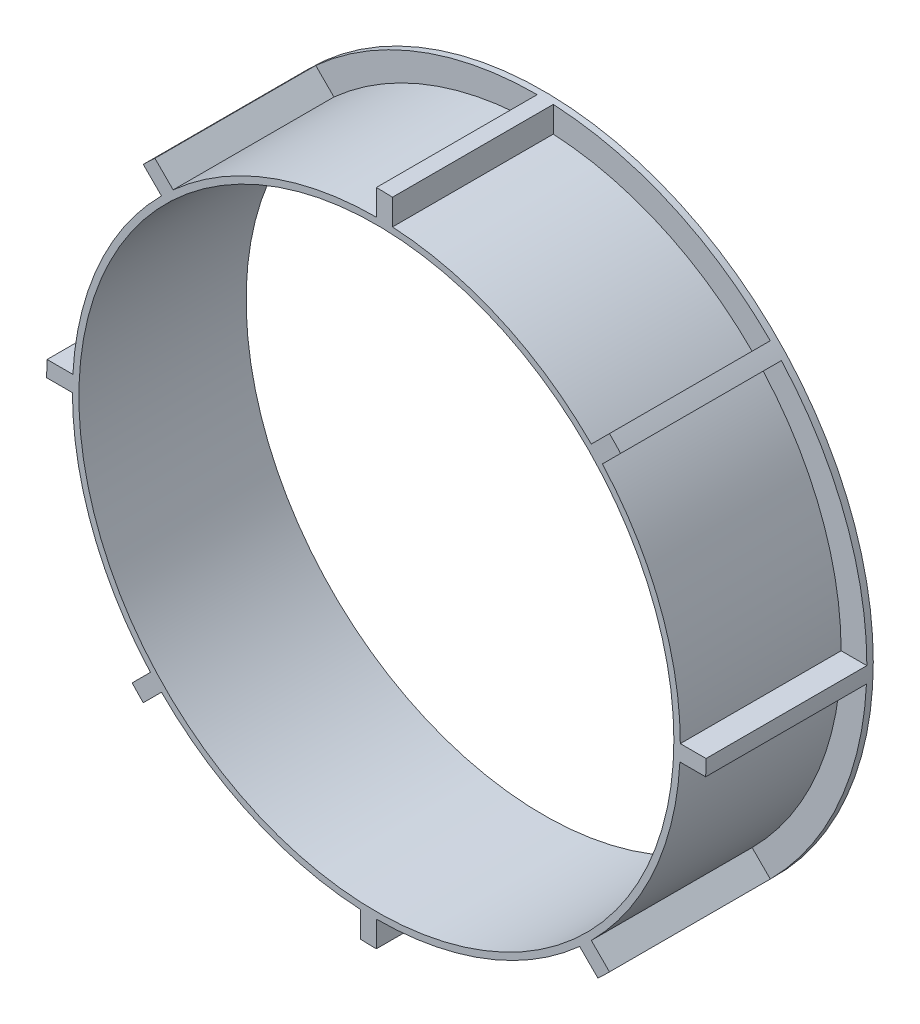
from build123d import *
from build123d.topology import SkipClean

# Parameters (mm, degrees)
SKETCH1_R           = 102.5
SKETCH1_R_2         = 92.5
BOSS_EXTRUDE1_DEPTH = 2
SKETCH2_R           = 94.5
SKETCH2_R_2         = 92.5
BOSS_EXTRUDE2_DEPTH = 50
BOSS_EXTRUDE3_DEPTH = 50
CIRPATTERN1_COUNT   = 8


with BuildPart() as part:
    # Sketch1 → Boss-Extrude1 (new body)
    with BuildSketch(Plane.XY):
        Circle(SKETCH1_R)
        Circle(SKETCH1_R_2, mode=Mode.SUBTRACT)
    extrude(amount=BOSS_EXTRUDE1_DEPTH)

    # Sketch2 → Boss-Extrude2 (add)
    with BuildSketch(Plane.XY.offset(2)):
        Circle(SKETCH2_R)
        Circle(SKETCH2_R_2, mode=Mode.SUBTRACT)
    extrude(amount=BOSS_EXTRUDE2_DEPTH)

    # Sketch3 → Boss-Extrude3 (add)
    with BuildSketch(Plane.XY.offset(2)):
        with BuildLine():
            Line((0, 102.5), (0, 94.5))
            ThreePointArc((0, 94.5), (2.500875909, 94.466902245), (5, 94.367632163))
            Line((5, 94.367632163), (5, 102.377976147))
            ThreePointArc((5, 102.377976147), (2.50074438, 102.469489496), (0, 102.5))
        make_face()
    boss_extrude3 = extrude(amount=BOSS_EXTRUDE3_DEPTH)

    # CirPattern1: Boss-Extrude3 ×8 about axis
    with SkipClean():  # the faces are left unmerged after this step: merging them gives an invalid solid
        cirpattern1_axis = Axis((0, 0, 0), (0, 0, 1))
        for i in range(1, CIRPATTERN1_COUNT):
            add(boss_extrude3.rotate(cirpattern1_axis, i * 360 / CIRPATTERN1_COUNT))


solid = part.part
